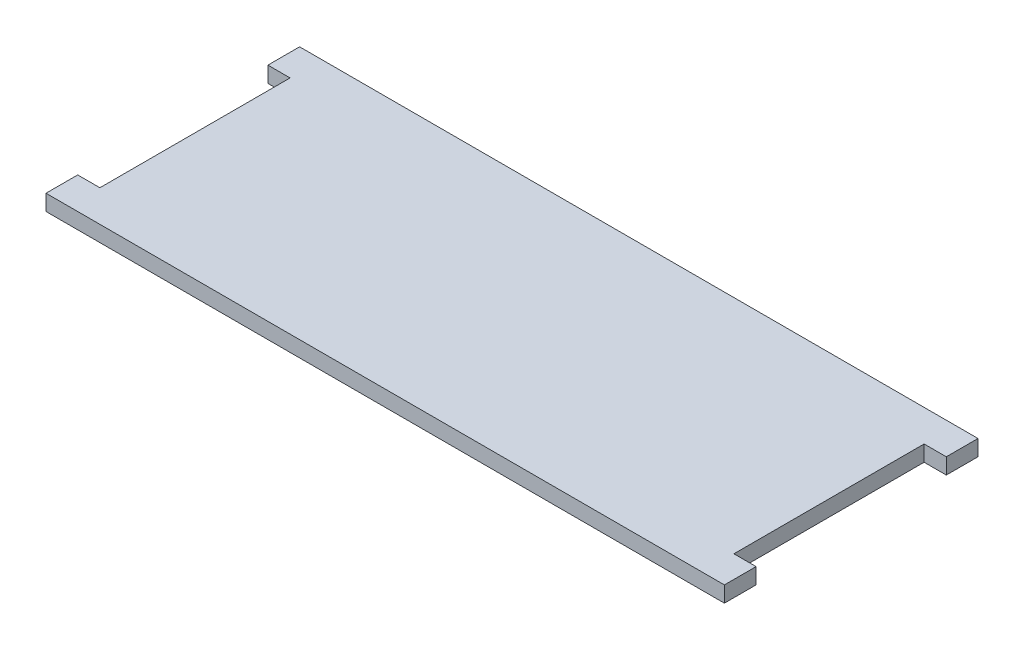
from build123d import *

# Parameters (mm, degrees)
SKETCH1_W           = 127
SKETCH1_H           = 50.8
SKETCH1_W_2         = 4.445
SKETCH1_H_2         = 6.35
BOSS_EXTRUDE1_DEPTH = 3.175


with BuildPart() as part:
    # Sketch1 → Boss-Extrude1 (new body)
    with BuildSketch(Plane(origin=(0, 0, 0), x_dir=(1, 0, 0), z_dir=(0, 1, 0))):
        Rectangle(SKETCH1_W, SKETCH1_H)
        with Locations((-65.7225, 22.225)):
            Rectangle(SKETCH1_W_2, SKETCH1_H_2)
        with Locations((-65.7225, -22.225)):
            Rectangle(SKETCH1_W_2, SKETCH1_H_2)
        with Locations((65.7225, -22.225)):
            Rectangle(SKETCH1_W_2, SKETCH1_H_2)
        with Locations((65.7225, 22.225)):
            Rectangle(SKETCH1_W_2, SKETCH1_H_2)
    extrude(amount=BOSS_EXTRUDE1_DEPTH)


solid = part.part
